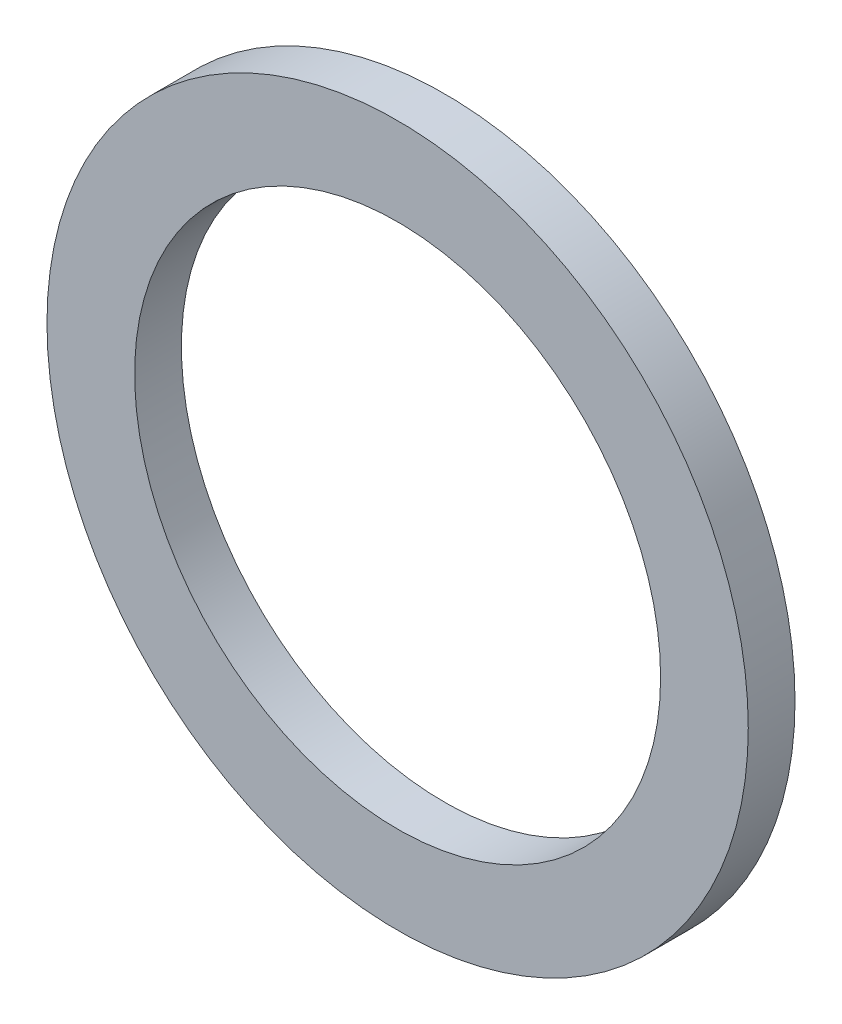
from build123d import *

# Parameters (mm, degrees)
ESQUISSE1_R        = 3
ESQUISSE1_R_2      = 2.25
BOSS_EXTRU_1_DEPTH = 0.4


with BuildPart() as part:
    # Esquisse1 → Boss.-Extru.1 (new body)
    with BuildSketch(Plane.XY):
        Circle(ESQUISSE1_R)
        Circle(ESQUISSE1_R_2, mode=Mode.SUBTRACT)
    extrude(amount=BOSS_EXTRU_1_DEPTH)


solid = part.part
